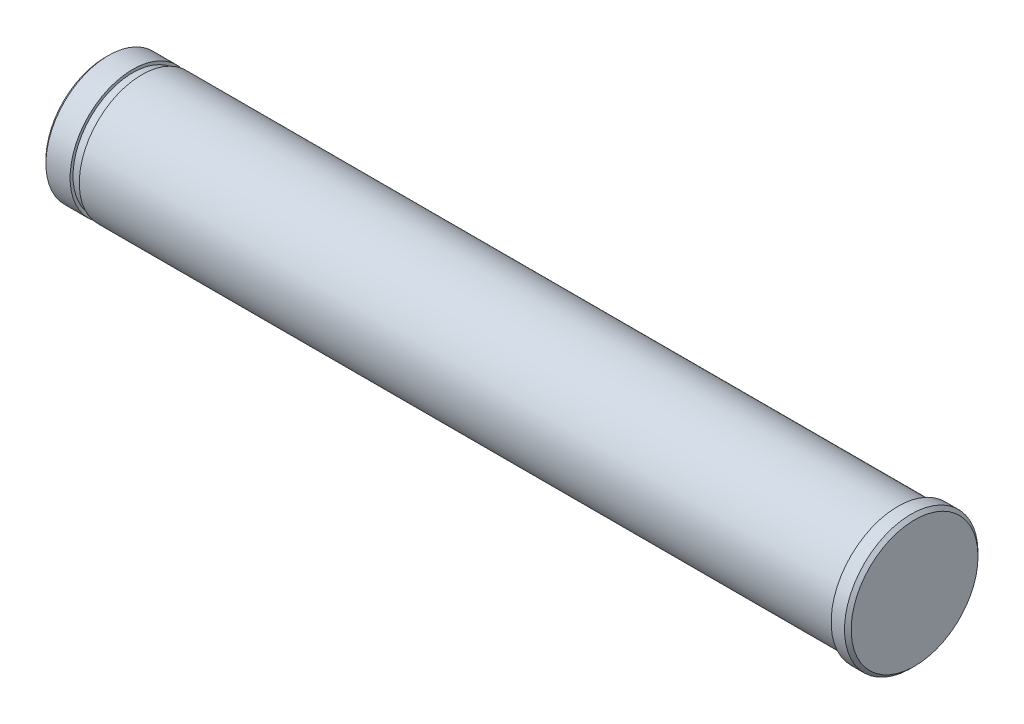
from build123d import *

# Parameters (mm, degrees)
SKETCH1_R           = 7.5
BOSS_EXTRUDE1_DEPTH = 47.5
SKETCH2_R           = 8
BOSS_EXTRUDE2_DEPTH = 2
SKETCH3_W           = 1.1
SKETCH3_H           = 0.35
CHAMFER1_SIZE       = 0.4


with BuildPart() as part:
    # Sketch1 → Boss-Extrude1 (new, symmetric)
    with BuildSketch(Plane(origin=(0, 0, 0), x_dir=(0, 0, -1), z_dir=(1, 0, 0))):
        Circle(SKETCH1_R)
    extrude(amount=BOSS_EXTRUDE1_DEPTH, both=True)

    # Sketch2 → Boss-Extrude2 (add)
    with BuildSketch(Plane(origin=(47.5, 0, 0), x_dir=(0, 0, -1), z_dir=(1, 0, 0))):
        Circle(SKETCH2_R)
    extrude(amount=BOSS_EXTRUDE2_DEPTH)

    # Sketch3 → Cut-Revolve1 (revolve, cut)
    with BuildSketch(Plane(origin=(0, 0, 0), x_dir=(1, 0, 0), z_dir=(0, 1, 0))):
        with Locations((-43.65, 7.325)):
            Rectangle(SKETCH3_W, SKETCH3_H)
    revolve(axis=Axis((0, 0, 0), (-1, 0, 0)), mode=Mode.SUBTRACT)

    # Chamfer1
    chamfer1_edges = [part.edges().sort_by_distance(p)[0] for p in [
        (-47.5, 0, 7.5),
        (49.5, 0, 8),
    ]]
    chamfer(chamfer1_edges, length=CHAMFER1_SIZE)


solid = part.part
